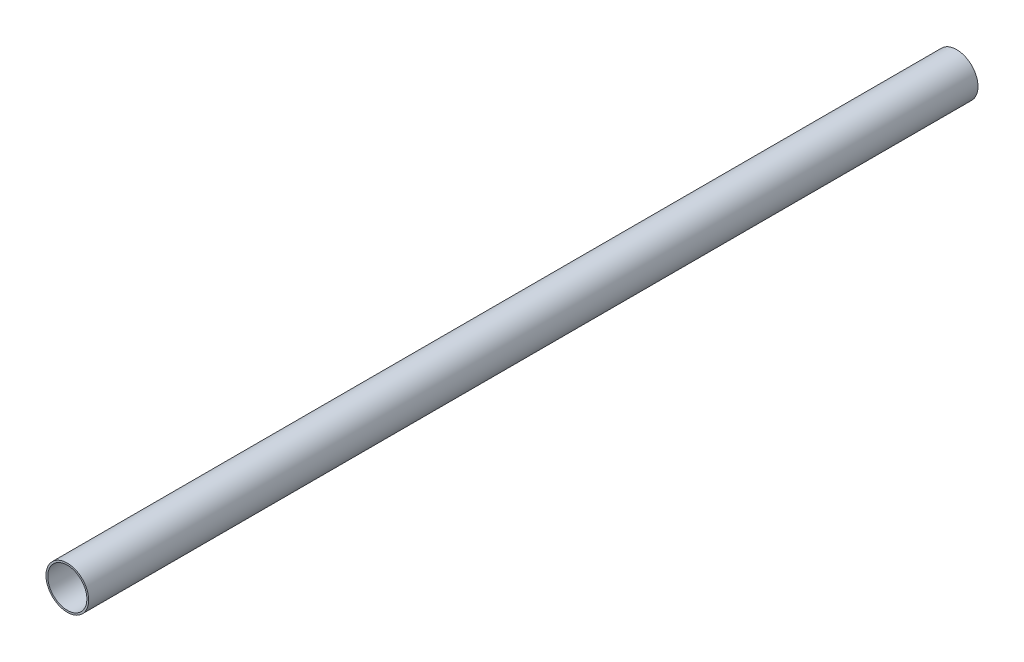
from build123d import *

# Parameters (mm, degrees)
SKETCH1_R           = 6
SKETCH1_R_2         = 5.5
BOSS_EXTRUDE1_DEPTH = 250


with BuildPart() as part:
    # Sketch1 → Boss-Extrude1 (new body)
    with BuildSketch(Plane.XY):
        Circle(SKETCH1_R)
        Circle(SKETCH1_R_2, mode=Mode.SUBTRACT)
    extrude(amount=BOSS_EXTRUDE1_DEPTH)


solid = part.part
